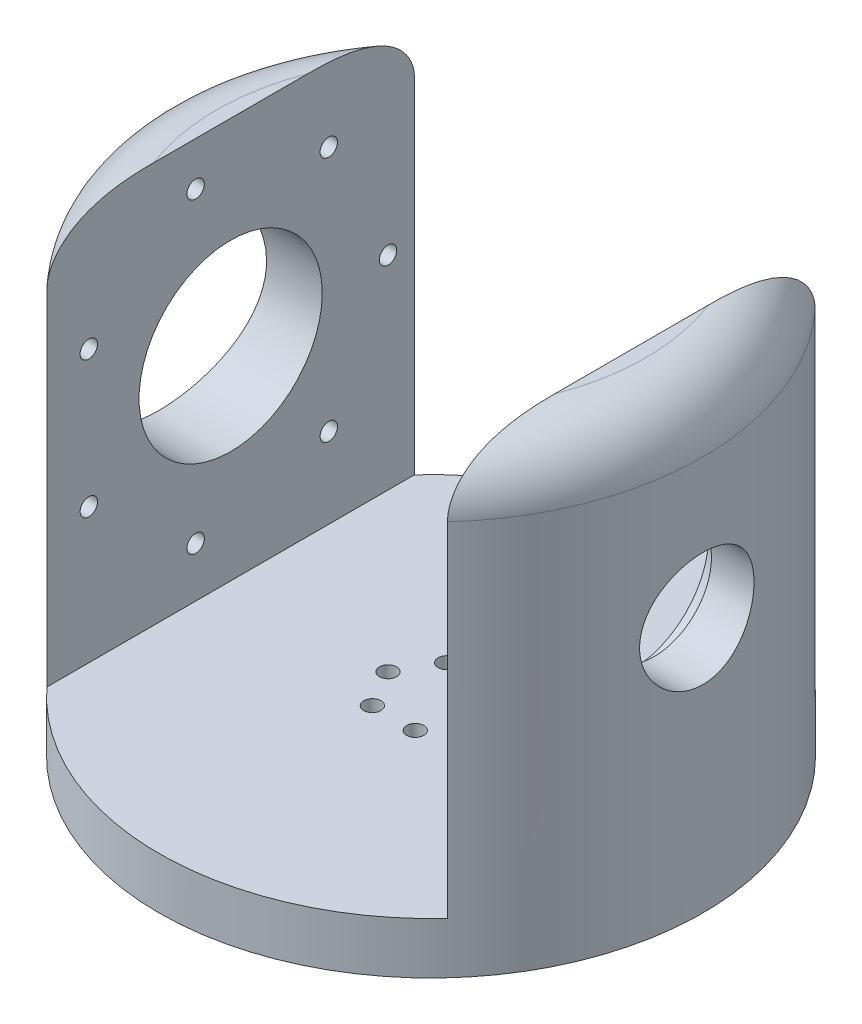
from build123d import *

# Parameters (mm, degrees)
CROQUIS1_R              = 47.5
CROQUIS1_R_2            = 10
SALIENTE_EXTRUIR1_DEPTH = 6
CROQUIS2_R              = 47.5
CROQUIS2_R_2            = 1.5
SALIENTE_EXTRUIR2_DEPTH = 3
CROQUIS3_R              = 45
CROQUIS3_R_2            = 32.5
CORTAR_EXTRUIR1_DEPTH   = 3
CROQUIS4_R              = 13.5
CORTAR_EXTRUIR2_DEPTH   = 4
SALIENTE_EXTRUIR4_DEPTH = 70
REDONDEO1_R             = 10
CROQUIS6_R              = 13.5
CORTAR_EXTRUIR3_DEPTH   = 4
CROQUIS7_R              = 10
CORTAR_EXTRUIR4_DEPTH   = 124.707316002
CROQUIS8_R              = 23.5
CROQUIS8_R_2            = 15
CORTAR_EXTRUIR5_DEPTH   = 2
CROQUIS10_R             = 16
CORTAR_EXTRUIR6_DEPTH   = 124.707316002
CROQUIS12_R             = 1.52
CORTAR_EXTRUIR8_DEPTH   = 124.707316002


with BuildPart() as part:
    # Croquis1 → Saliente-Extruir1 (new body)
    with BuildSketch(Plane(origin=(0, 0, 0), x_dir=(1, 0, 0), z_dir=(0, 1, 0))):
        with Locations(Location((0, 0, 0), (0, 0, 270))):
            Circle(CROQUIS1_R)
        with Locations(Location((0, 0, 0), (0, 0, 270))):
            Circle(CROQUIS1_R_2, mode=Mode.SUBTRACT)
    extrude(amount=SALIENTE_EXTRUIR1_DEPTH)

    # Croquis2 → Saliente-Extruir2 (add)
    with BuildSketch(Plane(origin=(0, 6, 0), x_dir=(1, 0, 0), z_dir=(0, 1, 0))):
        with Locations(Location((0, 0, 0), (0, 0, 270))):
            Circle(CROQUIS2_R)
        with Locations(Location((7.5, 0, 0), (0, 0, 270))):
            Circle(CROQUIS2_R_2, mode=Mode.SUBTRACT)
        with Locations(Location((3.75, -6.495190528, 0), (0, 0, 270))):
            Circle(CROQUIS2_R_2, mode=Mode.SUBTRACT)
        with Locations(Location((-3.75, -6.495190528, 0), (0, 0, 270))):
            Circle(CROQUIS2_R_2, mode=Mode.SUBTRACT)
        with Locations(Location((-7.5, 0, 0), (0, 0, 270))):
            Circle(CROQUIS2_R_2, mode=Mode.SUBTRACT)
        with Locations(Location((-3.75, 6.495190528, 0), (0, 0, 270))):
            Circle(CROQUIS2_R_2, mode=Mode.SUBTRACT)
        with Locations(Location((3.75, 6.495190528, 0), (0, 0, 270))):
            Circle(CROQUIS2_R_2, mode=Mode.SUBTRACT)
    extrude(amount=SALIENTE_EXTRUIR2_DEPTH)

    # Croquis3 → Cortar-Extruir1 (cut)
    with BuildSketch(Plane.XZ):
        with Locations(Location((0, 0, 0), (0, 0, 270))):
            Circle(CROQUIS3_R)
        with Locations(Location((0, 0, 0), (0, 0, 270))):
            Circle(CROQUIS3_R_2, mode=Mode.SUBTRACT)
    extrude(amount=-CORTAR_EXTRUIR1_DEPTH, mode=Mode.SUBTRACT)

    # Croquis4 → Cortar-Extruir2 (cut)
    with BuildSketch(Plane.XZ):
        with Locations(Location((0, 0, 0), (0, 0, 270))):
            Circle(CROQUIS4_R)
    extrude(amount=-CORTAR_EXTRUIR2_DEPTH, mode=Mode.SUBTRACT)

    # Croquis5 → Saliente-Extruir4 (add)
    with BuildSketch(Plane(origin=(0, 9, 0), x_dir=(1, 0, 0), z_dir=(0, 1, 0))):
        with BuildLine():
            Line((35, 32.113081447), (35, -32.113081447))
            ThreePointArc((35, -32.113081447), (47.5, 0), (35, 32.113081447))
        make_face()
        with BuildLine():
            Line((-35, 32.113081447), (-35, -32.113081447))
            ThreePointArc((-35, -32.113081447), (-47.5, 0), (-35, 32.113081447))
        make_face()
    extrude(amount=SALIENTE_EXTRUIR4_DEPTH)

    # Redondeo1
    redondeo1_edges = [part.edges().sort_by_distance(p)[0] for p in [
        (47.5, 79, 0),
        (-47.5, 79, 0),
    ]]
    fillet(redondeo1_edges, radius=REDONDEO1_R)

    # Croquis6 → Cortar-Extruir3 (cut)
    with BuildSketch(Plane.ZY.offset(-35)):
        with Locations((0, 44)):
            Circle(CROQUIS6_R)
    extrude(amount=-CORTAR_EXTRUIR3_DEPTH, mode=Mode.SUBTRACT)

    # Croquis7 → Cortar-Extruir4 (cut, through all)
    with BuildSketch(Plane.ZY.offset(-35)):
        with Locations((0, 44.554429855)):
            Circle(CROQUIS7_R)
    extrude(amount=-CORTAR_EXTRUIR4_DEPTH, mode=Mode.SUBTRACT)

    # Croquis8 → Cortar-Extruir5 (cut)
    with BuildSketch(Plane.ZY.offset(-35)):
        with Locations((0, 44.5)):
            Circle(CROQUIS8_R)
        with Locations((0, 44.5)):
            Circle(CROQUIS8_R_2, mode=Mode.SUBTRACT)
    extrude(amount=-CORTAR_EXTRUIR5_DEPTH, mode=Mode.SUBTRACT)

    # Croquis10 → Cortar-Extruir6 (cut, through all)
    with BuildSketch(Plane(origin=(-35, 0, 0), x_dir=(0, 0, -1), z_dir=(1, 0, 0))):
        with Locations((0, 44.554429855)):
            Circle(CROQUIS10_R)
    extrude(amount=-CORTAR_EXTRUIR6_DEPTH, mode=Mode.SUBTRACT)

    # Croquis12 → Cortar-Extruir8 (cut, through all)
    with BuildSketch(Plane(origin=(-35, 0, 0), x_dir=(0, 0, -1), z_dir=(1, 0, 0))):
        with Locations((27.5, 44.554429855)):
            Circle(CROQUIS12_R)
        with Locations((17.149432951, 23.052396202)):
            Circle(CROQUIS12_R)
        with Locations((-6.115006895, 17.73849668)):
            Circle(CROQUIS12_R)
        with Locations((-24.774721825, 32.614206013)):
            Circle(CROQUIS12_R)
        with Locations((-24.778565909, 56.477811664)):
            Circle(CROQUIS12_R)
        with Locations((-6.123644473, 71.35953185)):
            Circle(CROQUIS12_R)
        with Locations((17.142506151, 66.053127737)):
            Circle(CROQUIS12_R)
    extrude(amount=-CORTAR_EXTRUIR8_DEPTH, mode=Mode.SUBTRACT)


solid = part.part
